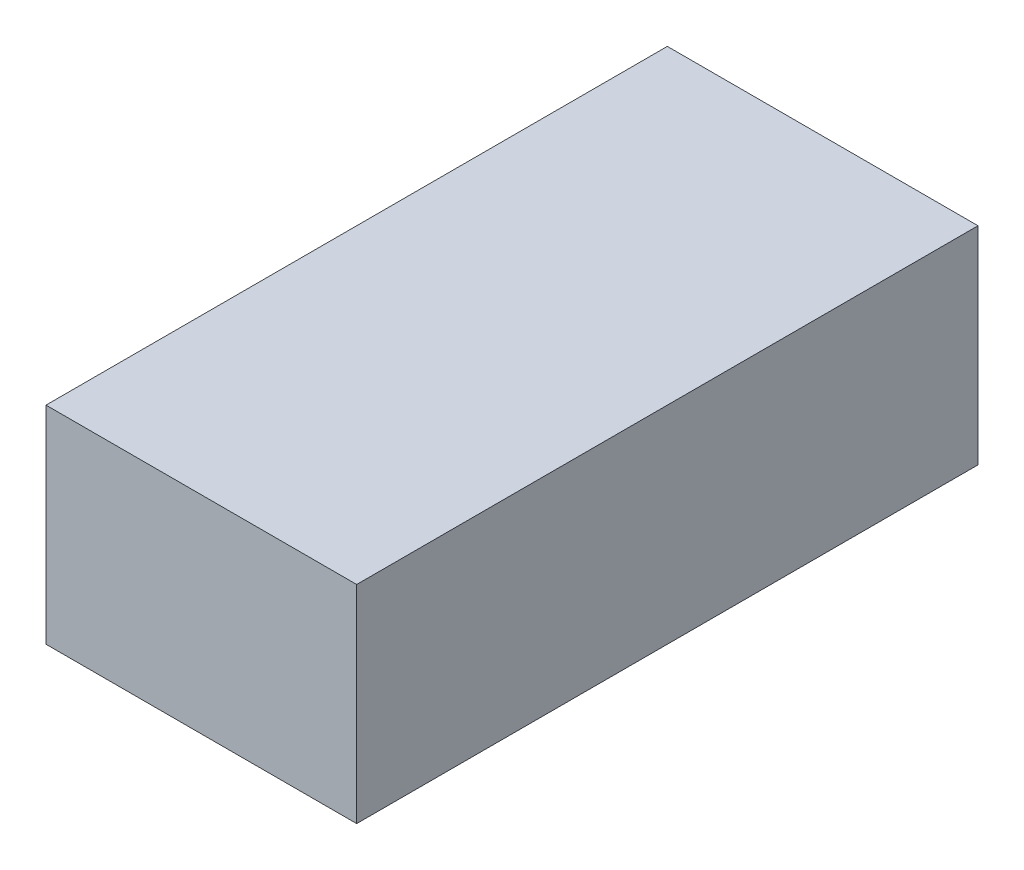
from build123d import *

# Parameters (mm, degrees)
SKETCH1_W           = 30
SKETCH1_H           = 20
BOSS_EXTRUDE1_DEPTH = 60


with BuildPart() as part:
    # Sketch1 → Boss-Extrude1 (new body)
    with BuildSketch(Plane.XY):
        with Locations((-10, 4.876033058)):
            Rectangle(SKETCH1_W, SKETCH1_H)
    extrude(amount=BOSS_EXTRUDE1_DEPTH)


solid = part.part
